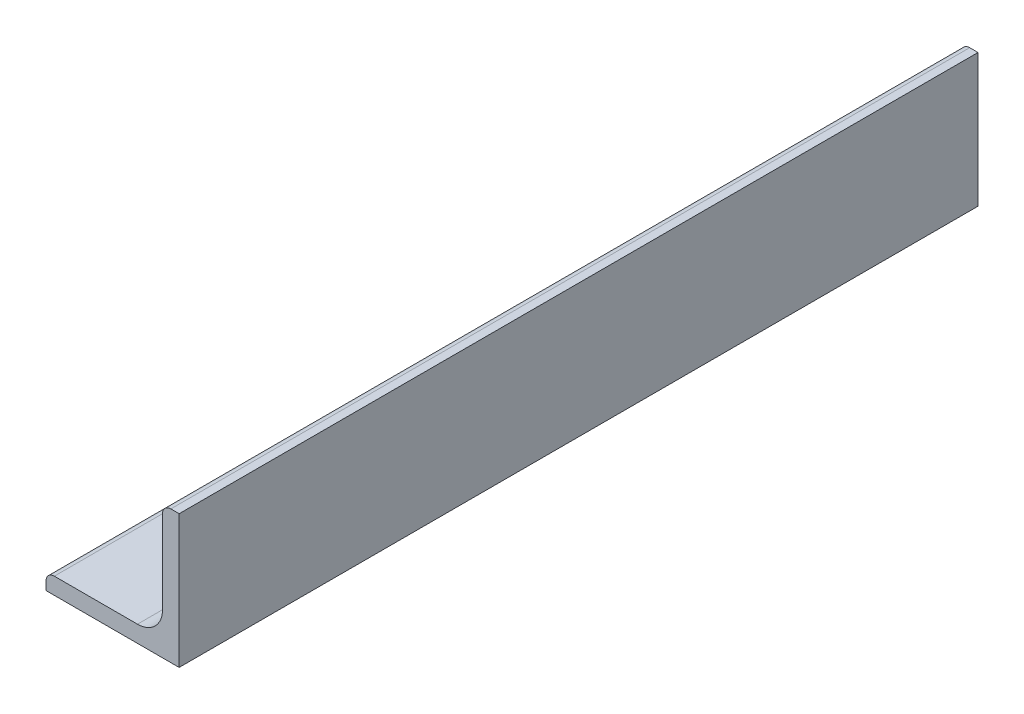
from build123d import *

# Parameters (mm, degrees)
BOSS_EXTRUDE1_DEPTH = 76.2


with BuildPart() as part:
    # Sketch2 → Boss-Extrude1 (new, symmetric)
    with BuildSketch(Plane.XY):
        with BuildLine():
            Line((-12.7, -12.7), (12.7, -12.7))
            Line((12.7, -12.7), (12.7, 12.7))
            Line((12.7, 12.7), (11.1125, 12.7))
            ThreePointArc((11.1125, 12.7), (9.989967985, 12.235032015), (9.525, 11.1125))
            Line((9.525, 11.1125), (9.525, -4.7498))
            ThreePointArc((9.525, -4.7498), (8.126376302, -8.126376302), (4.7498, -9.525))
            Line((4.7498, -9.525), (-11.1125, -9.525))
            ThreePointArc((-11.1125, -9.525), (-12.235032015, -9.989967985), (-12.7, -11.1125))
            Line((-12.7, -11.1125), (-12.7, -12.7))
        make_face()
    extrude(amount=BOSS_EXTRUDE1_DEPTH, both=True)


solid = part.part
